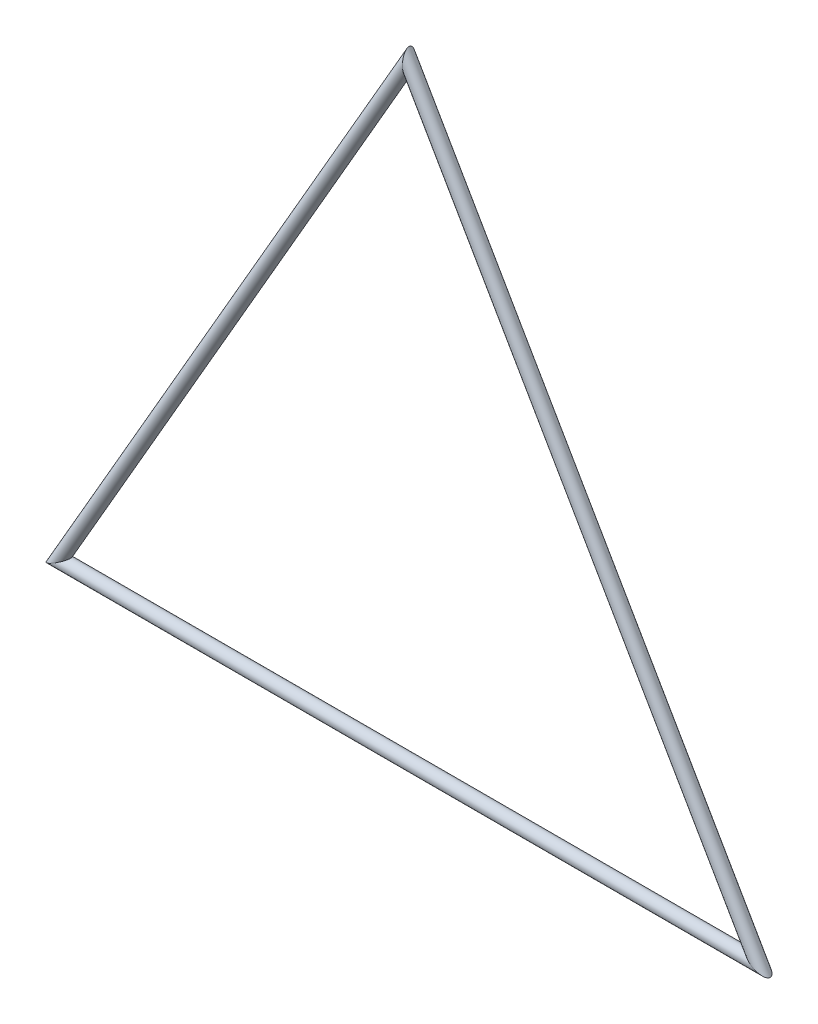
from build123d import *

# Parameters (mm, degrees)
STRUCTURAL_MEMBER1_DEPTH      = 1560.099742815
STRUCTURAL_MEMBER1_DEPTH_BACK = 36.099742815
SKETCH11_R                    = 14.32941
SKETCH11_ON_SEGMENT_2_R       = 14.32941
STRUCTURAL_MEMBER1_2_DEPTH    = 1596.19948563
SKETCH11_ON_SEGMENT_3_R       = 14.32941
STRUCTURAL_MEMBER1_3_DEPTH    = 1596.19948563


with BuildPart() as part:
    # Sketch11 → Structural Member1 (new, two sides: drawn at the far end of the back side and taken through both)
    with BuildSketch(Plane(origin=(762, 1319.822715367, 0), x_dir=(0.8660254037844399, -0.49999999999999784, 0), z_dir=(-0.49999999999999784, -0.8660254037844399, 0)).offset(-STRUCTURAL_MEMBER1_DEPTH_BACK)):
        Circle(SKETCH11_R)
    extrude(amount=STRUCTURAL_MEMBER1_DEPTH + STRUCTURAL_MEMBER1_DEPTH_BACK)

    # Structural Member1 mitre 1
    split(bisect_by=Plane(origin=(762, 1319.822715367, 0), x_dir=(0, -1, 0), z_dir=(-1, 0, 0)), keep=Keep.TOP)

    # Structural Member1 mitre 2
    split(bisect_by=Plane(origin=(0, 0, 0), x_dir=(-0.866025404, -0.5, 0), z_dir=(-0.5, 0.866025404, 0)), keep=Keep.TOP)


with BuildPart() as body_2:
    # Sketch11 on segment 2 (carried to segment 2) → Structural Member1 2 (new body)
    with BuildSketch(Plane.YZ.offset(-36.099742815)):
        Circle(SKETCH11_ON_SEGMENT_2_R)
    extrude(amount=STRUCTURAL_MEMBER1_2_DEPTH)

    # Structural Member1 2 mitre 1
    split(bisect_by=Plane(origin=(0, 0, 0), x_dir=(0.866025404, 0.5, 0), z_dir=(0.5, -0.866025404, 0)), keep=Keep.TOP)

    # Structural Member1 2 mitre 2
    split(bisect_by=Plane(origin=(1524, 0, 0), x_dir=(0.866025404, -0.5, 0), z_dir=(-0.5, -0.866025404, 0)), keep=Keep.TOP)


with BuildPart() as body_3:
    # Sketch11 on segment 3 (carried to segment 3) → Structural Member1 3 (new body)
    with BuildSketch(Plane(origin=(1542.049871408, -31.263294348, 0), x_dir=(-0.866025404, -0.5, 0), z_dir=(-0.5, 0.866025404, 0))):
        Circle(SKETCH11_ON_SEGMENT_3_R)
    extrude(amount=STRUCTURAL_MEMBER1_3_DEPTH)

    # Structural Member1 3 mitre 1
    split(bisect_by=Plane(origin=(1524, 0, 0), x_dir=(-0.866025404, 0.5, 0), z_dir=(0.5, 0.866025404, 0)), keep=Keep.TOP)

    # Structural Member1 3 mitre 2
    split(bisect_by=Plane(origin=(762, 1319.822715367, 0), x_dir=(0, 1, 0), z_dir=(1, 0, 0)), keep=Keep.TOP)


solid = Compound([part.part, body_2.part, body_3.part])
